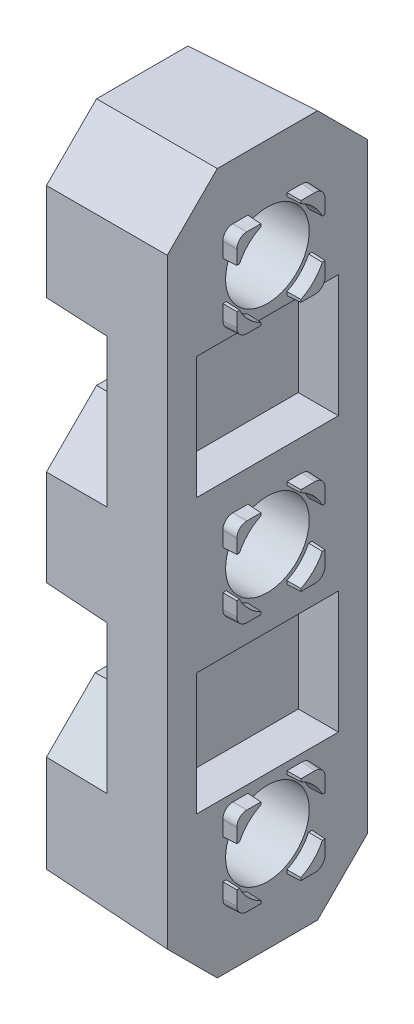
from build123d import *

# Parameters (mm, degrees)
SKETCH1_W                 = 9.716506228
SKETCH1_H                 = 35.116506228
BOSS_EXTRUDE1_DEPTH       = 6.35
CUT_EXTRUDE1_DEPTH        = 3.175
CUT_EXTRUDE2_DEPTH        = 3.175
CUT_EXTRUDE3_DEPTH        = 3.175
CUT_EXTRUDE4_DEPTH        = 3.175
BOSS_EXTRUDE2_DEPTH       = 0.6858
BOSS_EXTRUDE2_TAPER       = 2
BOSS_EXTRUDE3_DEPTH       = 0.6858
BOSS_EXTRUDE3_TAPER       = 2
BOSS_EXTRUDE4_DEPTH       = 0.6858
BOSS_EXTRUDE4_TAPER       = 2
BOSS_EXTRUDE5_DEPTH       = 0.6858
BOSS_EXTRUDE5_TAPER       = 2
BOSS_EXTRUDE6_DEPTH       = 0.6858
BOSS_EXTRUDE6_TAPER       = 2
BOSS_EXTRUDE7_DEPTH       = 0.6858
BOSS_EXTRUDE7_TAPER       = 2
BOSS_EXTRUDE8_DEPTH       = 0.6858
BOSS_EXTRUDE8_TAPER       = 2
BOSS_EXTRUDE9_DEPTH       = 0.6858
BOSS_EXTRUDE9_TAPER       = 2
BOSS_EXTRUDE10_DEPTH      = 0.6858
BOSS_EXTRUDE10_TAPER      = 2
BOSS_EXTRUDE11_DEPTH      = 0.6858
BOSS_EXTRUDE11_TAPER      = 2
BOSS_EXTRUDE12_DEPTH      = 0.6858
BOSS_EXTRUDE12_TAPER      = 2
BOSS_EXTRUDE13_DEPTH      = 0.6858
BOSS_EXTRUDE13_TAPER      = 2
SKETCH18_W                = 7.200000746
SKETCH18_H                = 6.200001039
CUT_EXTRUDE5_DEPTH        = 2.032
SKETCH19_W                = 7.200000746
SKETCH19_H                = 6.200000866
CUT_EXTRUDE6_DEPTH        = 2.032
DRAFT1_ANGLE              = 2.827279459
DRAFT2_ANGLE              = 2
F_6_CLEARANCE_HOLE1_D     = 4.2418
F_6_CLEARANCE_HOLE1_DEPTH = 7.0358
CHAMFER1_SIZE             = 2.536908263
CHAMFER1_EDGE_2_SIZE      = 2.536908263
CHAMFER1_EDGE_3_SIZE      = 2.536908263
CHAMFER1_EDGE_4_SIZE      = 2.536908263
FILLET1_R                 = 0.507999989


with BuildPart() as part:
    # Sketch1 → Boss-Extrude1 (new body)
    with BuildSketch(Plane(origin=(88.976200533, 0, 0), x_dir=(0, 0, -1), z_dir=(1, 0, 0))):
        with Locations((12.699999697, 26.416015382)):
            Rectangle(SKETCH1_W, SKETCH1_H)
    extrude(amount=-BOSS_EXTRUDE1_DEPTH)

    # Sketch2 → Cut-Extrude1 (cut)
    with BuildSketch(Plane.ZY.offset(-82.626200533)):
        Polygon((-7.841746583, 36.509270747), (-10.315251163, 34.035766168), (-11.699992639, 34.035766168), (-11.699992639, 31.385266496), (-10.380199322, 31.385266496), (-7.841746583, 28.846813757), align=None)
    extrude(amount=-CUT_EXTRUDE1_DEPTH, mode=Mode.SUBTRACT)

    # Sketch3 → Cut-Extrude2 (cut)
    with BuildSketch(Plane.ZY.offset(-82.626200533)):
        Polygon((-7.841746583, 23.985217007), (-10.380199322, 21.446764268), (-11.699997599, 21.446764268), (-11.699997599, 18.796264596), (-10.315251163, 18.796264596), (-7.841746583, 16.322760016), align=None)
    extrude(amount=-CUT_EXTRUDE2_DEPTH, mode=Mode.SUBTRACT)

    # Sketch4 → Cut-Extrude3 (cut)
    with BuildSketch(Plane.ZY.offset(-82.626200533)):
        Polygon((-17.558252811, 16.322760016), (-15.084748232, 18.796264596), (-13.699997366, 18.796264596), (-13.699997366, 21.446764268), (-15.019800072, 21.446764268), (-17.558252811, 23.985217007), align=None)
    extrude(amount=-CUT_EXTRUDE3_DEPTH, mode=Mode.SUBTRACT)

    # Sketch5 → Cut-Extrude4 (cut)
    with BuildSketch(Plane.ZY.offset(-82.626200533)):
        Polygon((-17.558252811, 28.846813757), (-15.019800072, 31.385266496), (-13.699992522, 31.385266496), (-13.699992522, 34.035766168), (-15.084748232, 34.035766168), (-17.558252811, 36.509270747), align=None)
    extrude(amount=-CUT_EXTRUDE4_DEPTH, mode=Mode.SUBTRACT)

    # Sketch6 → Boss-Extrude2 (add)
    with BuildSketch(Plane(origin=(88.976200533, 0, 0), x_dir=(0, 0, -1), z_dir=(1, 0, 0))):
        with BuildLine():
            ThreePointArc((11.709394811, 24.327642329), (11.065588197, 24.781603881), (10.611626644, 25.425410496))
            Line((10.611626644, 25.425410496), (10.439394811, 25.425410496))
            Line((10.439394811, 25.425410496), (10.439394811, 24.155410496))
            Line((10.439394811, 24.155410496), (11.709394811, 24.155410496))
            Line((11.709394811, 24.155410496), (11.709394811, 24.327642329))
        make_face()
    extrude(amount=BOSS_EXTRUDE2_DEPTH, taper=BOSS_EXTRUDE2_TAPER)

    # Sketch7 → Boss-Extrude3 (add)
    with BuildSketch(Plane(origin=(88.976200533, 0, 0), x_dir=(0, 0, -1), z_dir=(1, 0, 0))):
        with BuildLine():
            ThreePointArc((14.788362978, 25.425410496), (14.334401425, 24.781603881), (13.690594811, 24.327642329))
            Line((13.690594811, 24.327642329), (13.690594811, 24.155410496))
            Line((13.690594811, 24.155410496), (14.960594811, 24.155410496))
            Line((14.960594811, 24.155410496), (14.960594811, 25.425410496))
            Line((14.960594811, 25.425410496), (14.788362978, 25.425410496))
        make_face()
    extrude(amount=BOSS_EXTRUDE3_DEPTH, taper=BOSS_EXTRUDE3_TAPER)

    # Sketch8 → Boss-Extrude4 (add)
    with BuildSketch(Plane(origin=(88.976200533, 0, 0), x_dir=(0, 0, -1), z_dir=(1, 0, 0))):
        with BuildLine():
            ThreePointArc((13.690594811, 28.504378662), (14.334401425, 28.05041711), (14.788362978, 27.406610496))
            Line((14.788362978, 27.406610496), (14.960594811, 27.406610496))
            Line((14.960594811, 27.406610496), (14.960594811, 28.676610496))
            Line((14.960594811, 28.676610496), (13.690594811, 28.676610496))
            Line((13.690594811, 28.676610496), (13.690594811, 28.504378662))
        make_face()
    extrude(amount=BOSS_EXTRUDE4_DEPTH, taper=BOSS_EXTRUDE4_TAPER)

    # Sketch9 → Boss-Extrude5 (add)
    with BuildSketch(Plane(origin=(88.976200533, 0, 0), x_dir=(0, 0, -1), z_dir=(1, 0, 0))):
        with BuildLine():
            ThreePointArc((10.611626644, 27.406610496), (11.065588197, 28.05041711), (11.709394811, 28.504378662))
            Line((11.709394811, 28.504378662), (11.709394811, 28.676610496))
            Line((11.709394811, 28.676610496), (10.439394811, 28.676610496))
            Line((10.439394811, 28.676610496), (10.439394811, 27.406610496))
            Line((10.439394811, 27.406610496), (10.611626644, 27.406610496))
        make_face()
    extrude(amount=BOSS_EXTRUDE5_DEPTH, taper=BOSS_EXTRUDE5_TAPER)

    # Sketch10 → Boss-Extrude6 (add)
    with BuildSketch(Plane(origin=(88.976200533, 0, 0), x_dir=(0, 0, -1), z_dir=(1, 0, 0))):
        with BuildLine():
            ThreePointArc((11.709394811, 37.027642329), (11.065588197, 37.481603881), (10.611626644, 38.125410496))
            Line((10.611626644, 38.125410496), (10.439394811, 38.125410496))
            Line((10.439394811, 38.125410496), (10.439394811, 36.855410496))
            Line((10.439394811, 36.855410496), (11.709394811, 36.855410496))
            Line((11.709394811, 36.855410496), (11.709394811, 37.027642329))
        make_face()
    extrude(amount=BOSS_EXTRUDE6_DEPTH, taper=BOSS_EXTRUDE6_TAPER)

    # Sketch11 → Boss-Extrude7 (add)
    with BuildSketch(Plane(origin=(88.976200533, 0, 0), x_dir=(0, 0, -1), z_dir=(1, 0, 0))):
        with BuildLine():
            ThreePointArc((14.788362978, 38.125410496), (14.334401425, 37.481603881), (13.690594811, 37.027642329))
            Line((13.690594811, 37.027642329), (13.690594811, 36.855410496))
            Line((13.690594811, 36.855410496), (14.960594811, 36.855410496))
            Line((14.960594811, 36.855410496), (14.960594811, 38.125410496))
            Line((14.960594811, 38.125410496), (14.788362978, 38.125410496))
        make_face()
    extrude(amount=BOSS_EXTRUDE7_DEPTH, taper=BOSS_EXTRUDE7_TAPER)

    # Sketch12 → Boss-Extrude8 (add)
    with BuildSketch(Plane(origin=(88.976200533, 0, 0), x_dir=(0, 0, -1), z_dir=(1, 0, 0))):
        with BuildLine():
            ThreePointArc((13.690594811, 41.204378662), (14.334401425, 40.75041711), (14.788362978, 40.106610496))
            Line((14.788362978, 40.106610496), (14.960594811, 40.106610496))
            Line((14.960594811, 40.106610496), (14.960594811, 41.376610496))
            Line((14.960594811, 41.376610496), (13.690594811, 41.376610496))
            Line((13.690594811, 41.376610496), (13.690594811, 41.204378662))
        make_face()
    extrude(amount=BOSS_EXTRUDE8_DEPTH, taper=BOSS_EXTRUDE8_TAPER)

    # Sketch13 → Boss-Extrude9 (add)
    with BuildSketch(Plane(origin=(88.976200533, 0, 0), x_dir=(0, 0, -1), z_dir=(1, 0, 0))):
        with BuildLine():
            ThreePointArc((10.611626644, 40.106610496), (11.065588197, 40.75041711), (11.709394811, 41.204378662))
            Line((11.709394811, 41.204378662), (11.709394811, 41.376610496))
            Line((11.709394811, 41.376610496), (10.439394811, 41.376610496))
            Line((10.439394811, 41.376610496), (10.439394811, 40.106610496))
            Line((10.439394811, 40.106610496), (10.611626644, 40.106610496))
        make_face()
    extrude(amount=BOSS_EXTRUDE9_DEPTH, taper=BOSS_EXTRUDE9_TAPER)

    # Sketch14 → Boss-Extrude10 (add)
    with BuildSketch(Plane(origin=(88.976200533, 0, 0), x_dir=(0, 0, -1), z_dir=(1, 0, 0))):
        with BuildLine():
            ThreePointArc((11.709394811, 11.627642329), (11.065588197, 12.081603882), (10.611626644, 12.725410496))
            Line((10.611626644, 12.725410496), (10.439394811, 12.725410496))
            Line((10.439394811, 12.725410496), (10.439394811, 11.455410496))
            Line((10.439394811, 11.455410496), (11.709394811, 11.455410496))
            Line((11.709394811, 11.455410496), (11.709394811, 11.627642329))
        make_face()
    extrude(amount=BOSS_EXTRUDE10_DEPTH, taper=BOSS_EXTRUDE10_TAPER)

    # Sketch15 → Boss-Extrude11 (add)
    with BuildSketch(Plane(origin=(88.976200533, 0, 0), x_dir=(0, 0, -1), z_dir=(1, 0, 0))):
        with BuildLine():
            ThreePointArc((14.788362978, 12.725410496), (14.334401425, 12.081603882), (13.690594811, 11.627642329))
            Line((13.690594811, 11.627642329), (13.690594811, 11.455410496))
            Line((13.690594811, 11.455410496), (14.960594811, 11.455410496))
            Line((14.960594811, 11.455410496), (14.960594811, 12.725410496))
            Line((14.960594811, 12.725410496), (14.788362978, 12.725410496))
        make_face()
    extrude(amount=BOSS_EXTRUDE11_DEPTH, taper=BOSS_EXTRUDE11_TAPER)

    # Sketch16 → Boss-Extrude12 (add)
    with BuildSketch(Plane(origin=(88.976200533, 0, 0), x_dir=(0, 0, -1), z_dir=(1, 0, 0))):
        with BuildLine():
            ThreePointArc((13.690594811, 15.804378662), (14.334401425, 15.35041711), (14.788362978, 14.706610496))
            Line((14.788362978, 14.706610496), (14.960594811, 14.706610496))
            Line((14.960594811, 14.706610496), (14.960594811, 15.976610496))
            Line((14.960594811, 15.976610496), (13.690594811, 15.976610496))
            Line((13.690594811, 15.976610496), (13.690594811, 15.804378662))
        make_face()
    extrude(amount=BOSS_EXTRUDE12_DEPTH, taper=BOSS_EXTRUDE12_TAPER)

    # Sketch17 → Boss-Extrude13 (add)
    with BuildSketch(Plane(origin=(88.976200533, 0, 0), x_dir=(0, 0, -1), z_dir=(1, 0, 0))):
        with BuildLine():
            ThreePointArc((10.611626644, 14.706610496), (11.065588197, 15.35041711), (11.709394811, 15.804378662))
            Line((11.709394811, 15.804378662), (11.709394811, 15.976610496))
            Line((11.709394811, 15.976610496), (10.439394811, 15.976610496))
            Line((10.439394811, 15.976610496), (10.439394811, 14.706610496))
            Line((10.439394811, 14.706610496), (10.611626644, 14.706610496))
        make_face()
    extrude(amount=BOSS_EXTRUDE13_DEPTH, taper=BOSS_EXTRUDE13_TAPER)

    # Sketch18 → Cut-Extrude5 (cut)
    with BuildSketch(Plane(origin=(88.976200533, 0, 0), x_dir=(0, 0, -1), z_dir=(1, 0, 0))):
        with Locations((12.699998305, 19.46600963)):
            Rectangle(SKETCH18_W, SKETCH18_H)
    extrude(amount=-CUT_EXTRUDE5_DEPTH, mode=Mode.SUBTRACT)

    # Sketch19 → Cut-Extrude6 (cut)
    with BuildSketch(Plane(origin=(88.976200533, 0, 0), x_dir=(0, 0, -1), z_dir=(1, 0, 0))):
        with Locations((12.699992957, 33.366009543)):
            Rectangle(SKETCH19_W, SKETCH19_H)
    extrude(amount=-CUT_EXTRUDE6_DEPTH, mode=Mode.SUBTRACT)

    # Draft1
    draft1_faces = [part.faces().sort_by_distance(p)[0] for p in [
        (84.213700533, 30.116040126, -9.110972953),
        (84.213700533, 22.715990637, -9.110972953),
        (84.213700533, 22.715990637, -16.289026442),
        (84.213700533, 30.116040126, -16.289026442),
    ]]
    draft(draft1_faces, Plane(origin=(82.626200533, 0, 0), x_dir=(0, 0, -1), z_dir=(-1, 0, 0)), DRAFT1_ANGLE)

    # Draft2
    draft2_faces = [part.faces().sort_by_distance(p)[0] for p in [
        (85.801200533, 43.974268496, -12.699999697),
        (84.213700533, 35.272518458, -9.078498873),
        (84.213700533, 34.035766168, -11.007621901),
        (84.254709755, 31.385266496, -10.983227185),
        (84.254709612, 21.446764268, -10.98322967),
        (84.213700533, 18.796264596, -11.007624381),
        (84.213700533, 17.559512306, -9.078498873),
        (86.238234569, 26.416015382, -7.841746583),
        (85.801200533, 8.857762268, -12.699999697),
        (84.213700533, 17.559512306, -16.321500521),
        (84.213700533, 18.796264596, -14.392372799),
        (84.254709485, 21.446764268, -14.416767505),
        (84.254709347, 31.385266496, -14.416765078),
        (84.213700533, 34.035766168, -14.392370377),
        (84.213700533, 35.272518458, -16.321500521),
        (86.238234569, 26.416015382, -17.558252811),
    ]]
    draft(draft2_faces, Plane(origin=(82.626200533, 0, 0), x_dir=(0, 0, -1), z_dir=(-1, 0, 0)), DRAFT2_ANGLE)

    # #6 Clearance Hole1
    with Locations(Plane.ZY.offset(-82.626200533)):
        with Locations((-12.699994811, 26.416010496), (-12.699999697, 13.716015382), (-12.699999697, 39.116015382)):
            Hole(F_6_CLEARANCE_HOLE1_D / 2, depth=F_6_CLEARANCE_HOLE1_DEPTH)

    # Chamfer1
    chamfer1_edges = [part.edges().sort_by_distance(p)[0] for p in [
        (85.801200533, 44.085141939, -7.73087314),
    ]]
    chamfer(chamfer1_edges, length=CHAMFER1_SIZE)

    # Chamfer1 edge 2
    chamfer1_edge_2_edges = [part.edges().sort_by_distance(p)[0] for p in [
        (85.801200533, 44.085141939, -17.669126254),
    ]]
    chamfer(chamfer1_edge_2_edges, length=CHAMFER1_EDGE_2_SIZE)

    # Chamfer1 edge 3
    chamfer1_edge_3_edges = [part.edges().sort_by_distance(p)[0] for p in [
        (85.801200533, 8.746888825, -17.669126254),
    ]]
    chamfer(chamfer1_edge_3_edges, length=CHAMFER1_EDGE_3_SIZE)

    # Chamfer1 edge 4
    chamfer1_edge_4_edges = [part.edges().sort_by_distance(p)[0] for p in [
        (85.801200533, 8.746888825, -7.73087314),
    ]]
    chamfer(chamfer1_edge_4_edges, length=CHAMFER1_EDGE_4_SIZE)

    # Fillet1
    fillet1_edges = [part.edges().sort_by_distance(p)[0] for p in [
        (89.319100533, 24.167384827, -14.948620479),
        (89.319100533, 28.664636164, -14.948620479),
        (89.319100533, 28.664636164, -10.451369143),
        (89.319100533, 36.867384827, -10.451369143),
        (89.319100533, 36.867384827, -14.948620479),
        (89.319100533, 41.364636164, -14.948620479),
        (89.319100533, 41.364636164, -10.451369143),
        (89.319100533, 11.467384827, -10.451369143),
        (89.319100533, 11.467384827, -14.948620479),
        (89.319100533, 15.964636164, -14.948620479),
        (89.319100533, 15.964636164, -10.451369143),
        (89.319100533, 24.167384827, -10.451369143),
    ]]
    fillet(fillet1_edges, radius=FILLET1_R)


solid = part.part
